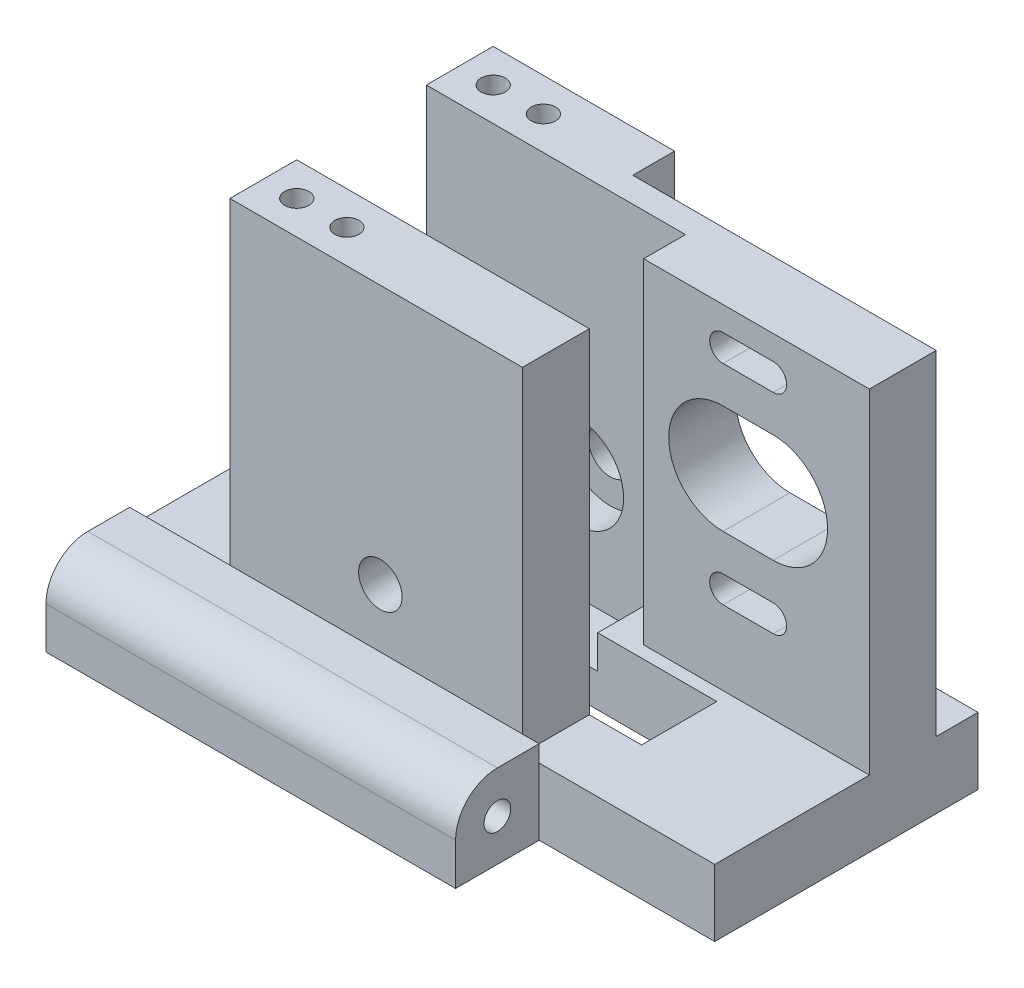
from build123d import *

# Parameters (mm, degrees)
SKETCH1_W           = 70
SKETCH1_H           = 31.5
BOSS_EXTRUDE1_DEPTH = 8
SKETCH2_W           = 35
SKETCH2_H           = 8
BOSS_EXTRUDE2_DEPTH = 20
SKETCH3_R           = 2.6
CUT_EXTRUDE1_DEPTH  = 82.70832271
SKETCH4_W           = 49
SKETCH4_H           = 10
BOSS_EXTRUDE3_DEPTH = 10
SKETCH5_R           = 1.6
CUT_EXTRUDE2_DEPTH  = 82.70832271
SKETCH6_W           = 46
SKETCH6_H           = 9
CUT_EXTRUDE3_DEPTH  = 80.323703897
SKETCH7_R           = 5.6
CUT_EXTRUDE4_DEPTH  = 4
CUT_EXTRUDE5_START  = -4
SKETCH8_R           = 5.6
CUT_EXTRUDE5_DEPTH  = 4
SKETCH9_W           = 18
SKETCH9_H           = 6.5
CUT_EXTRUDE6_DEPTH  = 4
BOSS_EXTRUDE5_DEPTH = 20
CUT_EXTRUDE10_DEPTH = 5
BOSS_EXTRUDE6_DEPTH = 20
CUT_EXTRUDE11_DEPTH = 88.93747779
SKETCH17_W          = 49
SKETCH17_H          = 10
BOSS_EXTRUDE7_DEPTH = 10
SKETCH18_R          = 1.6
CUT_EXTRUDE12_DEPTH = 95.478833608
SKETCH19_W          = 35
SKETCH19_H          = 8
BOSS_EXTRUDE8_DEPTH = 20
SKETCH23_R          = 1.45
CUT_EXTRUDE13_DEPTH = 95.478833608
FILLET1_R           = 5


with BuildPart() as part:
    # Sketch1 → Boss-Extrude1 (new body)
    with BuildSketch(Plane(origin=(0, 0, 0), x_dir=(1, 0, 0), z_dir=(0, 1, 0))):
        with Locations((35, -15.75)):
            Rectangle(SKETCH1_W, SKETCH1_H)
    extrude(amount=BOSS_EXTRUDE1_DEPTH)

    # Sketch2 → Boss-Extrude2 (add)
    with BuildSketch(Plane(origin=(0, 8, 0), x_dir=(1, 0, 0), z_dir=(0, 1, 0))):
        with Locations((29.5, -27.5)):
            Rectangle(SKETCH2_W, SKETCH2_H)
        with Locations((29.5, -4)):
            Rectangle(SKETCH2_W, SKETCH2_H)
    extrude(amount=BOSS_EXTRUDE2_DEPTH)

    # Sketch3 → Cut-Extrude1 (cut, through all)
    with BuildSketch(Plane.XY.offset(31.5)):
        with Locations((30, 17)):
            Circle(SKETCH3_R)
    extrude(amount=-CUT_EXTRUDE1_DEPTH, mode=Mode.SUBTRACT)

    # Sketch4 → Boss-Extrude3 (add)
    with BuildSketch(Plane(origin=(0, 0, 0), x_dir=(-1, 0, 0), z_dir=(0, 0, -1))):
        with Locations((-24.5, 5)):
            Rectangle(SKETCH4_W, SKETCH4_H)
    extrude(amount=BOSS_EXTRUDE3_DEPTH)

    # Sketch5 → Cut-Extrude2 (cut, through all)
    with BuildSketch(Plane.ZY):
        with Locations((-5, 5)):
            Circle(SKETCH5_R)
    extrude(amount=-CUT_EXTRUDE2_DEPTH, mode=Mode.SUBTRACT)

    # Sketch6 → Cut-Extrude3 (cut, through all)
    with BuildSketch(Plane(origin=(0, 8, 0), x_dir=(1, 0, 0), z_dir=(0, 1, 0))):
        with Locations((30.25, -19)):
            Rectangle(SKETCH6_W, SKETCH6_H)
    extrude(amount=-CUT_EXTRUDE3_DEPTH, mode=Mode.SUBTRACT)

    # Sketch7 → Cut-Extrude4 (cut)
    with BuildSketch(Plane.XY.offset(8)):
        with Locations((30, 17)):
            Circle(SKETCH7_R)
    extrude(amount=-CUT_EXTRUDE4_DEPTH, mode=Mode.SUBTRACT)

    # Sketch8 → Cut-Extrude5 (cut)
    with BuildSketch(Plane(origin=(0, 0, 23.5), x_dir=(-1, 0, 0), z_dir=(0, 0, -1)).offset(CUT_EXTRUDE5_START)):
        with Locations(Location((-30, 17, 0), (0, 0, 180))):
            Circle(SKETCH8_R)
    extrude(amount=CUT_EXTRUDE5_DEPTH, mode=Mode.SUBTRACT)

    # Sketch9 → Cut-Extrude6 (cut)
    with BuildSketch(Plane(origin=(0, 8, 0), x_dir=(1, 0, 0), z_dir=(0, 1, 0))):
        with Locations((30, -11.25)):
            Rectangle(SKETCH9_W, SKETCH9_H)
    extrude(amount=-CUT_EXTRUDE6_DEPTH, mode=Mode.SUBTRACT)

    # Sketch13 → Boss-Extrude5 (add)
    with BuildSketch(Plane(origin=(0, 8, 0), x_dir=(1, 0, 0), z_dir=(0, 1, 0))):
        Polygon((70, -13), (43, -13), (43, -8), (47, -8), (47, -5), (70, -5), align=None)
    extrude(amount=BOSS_EXTRUDE5_DEPTH)

    # Sketch14 → Cut-Extrude10 (cut)
    with BuildSketch(Plane(origin=(0, 0, 0), x_dir=(-1, 0, 0), z_dir=(0, 0, -1))):
        Polygon((-33.697877871, 28), (-40.874528252, 10), (-47, 10), (-47, 28), align=None)
    extrude(amount=-CUT_EXTRUDE10_DEPTH, mode=Mode.SUBTRACT)

    # Sketch15 → Boss-Extrude6 (add)
    with BuildSketch(Plane(origin=(0, 28, 0), x_dir=(1, 0, 0), z_dir=(0, 1, 0))):
        Polygon((70, -5), (70, -13), (43, -13), (43, -8), (33.697877871, -8), (24.157827733, -8), (12, -8), (12, 0), (24.157827733, 0), (33.697877871, 0), (33.697877871, -5), align=None)
    extrude(amount=BOSS_EXTRUDE6_DEPTH)

    # Sketch16 → Cut-Extrude11 (cut, through all)
    with BuildSketch(Plane.XY.offset(13)):
        with BuildLine():
            Line((52.5, 37.5), (58.5, 37.5))
            ThreePointArc((58.5, 37.5), (65, 31), (58.5, 24.5))
            Line((58.5, 24.5), (52.5, 24.5))
            ThreePointArc((52.5, 24.5), (46, 31), (52.5, 37.5))
        make_face()
        with BuildLine():
            Line((52.5, 45.1), (58.5, 45.1))
            ThreePointArc((58.5, 45.1), (60.1, 43.5), (58.5, 41.9))
            Line((58.5, 41.9), (52.5, 41.9))
            ThreePointArc((52.5, 41.9), (50.9, 43.5), (52.5, 45.1))
        make_face()
        with BuildLine():
            Line((52.5, 20.1), (58.5, 20.1))
            ThreePointArc((58.5, 20.1), (60.1, 18.5), (58.5, 16.9))
            Line((58.5, 16.9), (52.5, 16.9))
            ThreePointArc((52.5, 16.9), (50.9, 18.5), (52.5, 20.1))
        make_face()
    extrude(amount=-CUT_EXTRUDE11_DEPTH, mode=Mode.SUBTRACT)

    # Sketch17 → Boss-Extrude7 (add)
    with BuildSketch(Plane.XY.offset(31.5)):
        with Locations((24.5, 5)):
            Rectangle(SKETCH17_W, SKETCH17_H)
    extrude(amount=BOSS_EXTRUDE7_DEPTH)

    # Sketch18 → Cut-Extrude12 (cut, through all)
    with BuildSketch(Plane.ZY):
        with Locations((36.5, 5)):
            Circle(SKETCH18_R)
    extrude(amount=-CUT_EXTRUDE12_DEPTH, mode=Mode.SUBTRACT)

    # Sketch19 → Boss-Extrude8 (add)
    with BuildSketch(Plane(origin=(0, 28, 0), x_dir=(1, 0, 0), z_dir=(0, 1, 0))):
        with Locations((29.5, -27.5)):
            Rectangle(SKETCH19_W, SKETCH19_H)
    extrude(amount=BOSS_EXTRUDE8_DEPTH)

    # Sketch23 → Cut-Extrude13 (cut, through all)
    with BuildSketch(Plane(origin=(0, 48, 0), x_dir=(1, 0, 0), z_dir=(0, 1, 0))):
        with Locations(Location((16, -27.5, 0), (0, 0, 270))):
            Circle(SKETCH23_R)
        with Locations(Location((16, -4, 0), (0, 0, 270))):
            Circle(SKETCH23_R)
        with Locations(Location((22, -27.5, 0), (0, 0, 270))):
            Circle(SKETCH23_R)
        with Locations(Location((22, -4, 0), (0, 0, 270))):
            Circle(SKETCH23_R)
    extrude(amount=-CUT_EXTRUDE13_DEPTH, mode=Mode.SUBTRACT)

    # Fillet1
    fillet1_edges = [part.edges().sort_by_distance(p)[0] for p in [
        (24.5, 10, 41.5),
        (24.5, 10, -10),
    ]]
    fillet(fillet1_edges, radius=FILLET1_R)


solid = part.part
